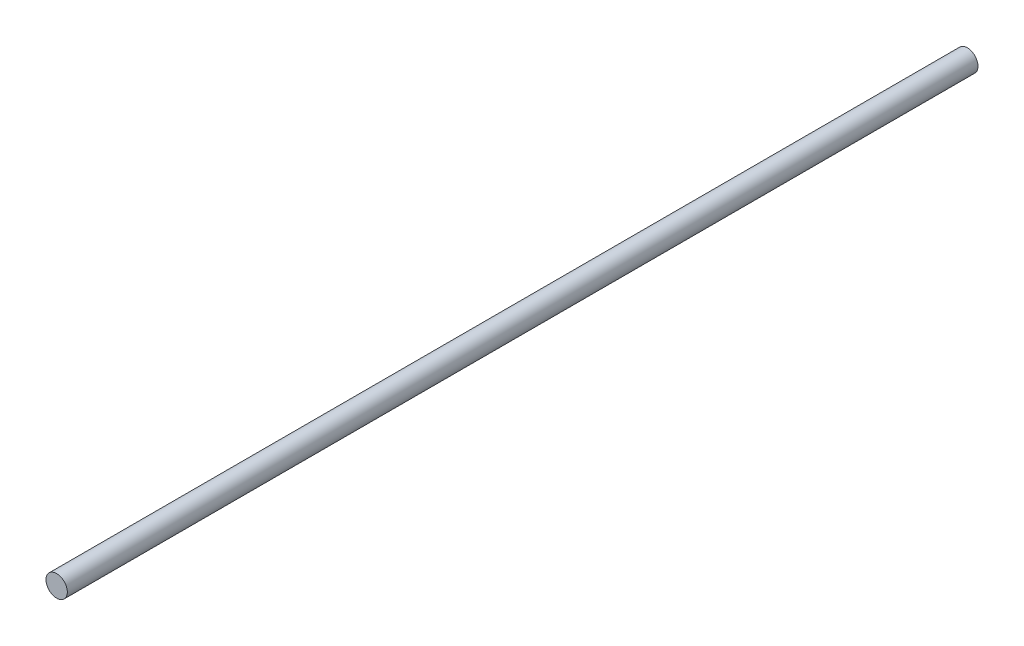
from build123d import *

# Parameters (mm, degrees)
ESQUISSE1_R        = 1.5
BOSS_EXTRU_1_DEPTH = 128


with BuildPart() as part:
    # Esquisse1 → Boss.-Extru.1 (new body)
    with BuildSketch(Plane.XY):
        Circle(ESQUISSE1_R)
    extrude(amount=BOSS_EXTRU_1_DEPTH)


solid = part.part
